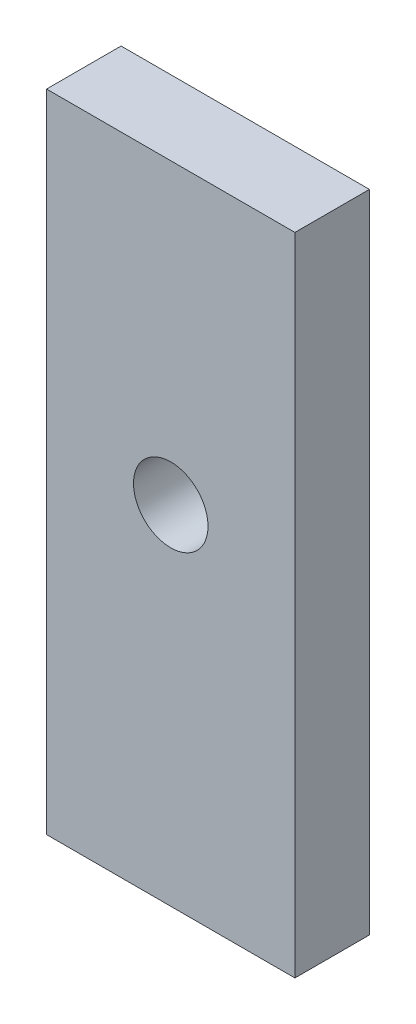
from build123d import *

# Parameters (mm, degrees)
SKETCH_1_W          = 10
SKETCH_1_H          = 26
EXTRUDE_1_DEPTH     = 3
SKETCH_2_R          = 1.5
CUT_EXTRUDE_1_DEPTH = 29.017851452


with BuildPart() as part:
    # Эскиз1 → Бобышка-Вытянуть1 (new body)
    with BuildSketch(Plane.XY):
        with Locations((5, 13)):
            Rectangle(SKETCH_1_W, SKETCH_1_H)
    extrude(amount=EXTRUDE_1_DEPTH)

    # Эскиз2 → Вырез-Вытянуть1 (cut, through all)
    with BuildSketch(Plane.XY.offset(3)):
        with Locations((5, 14)):
            Circle(SKETCH_2_R)
    extrude(amount=-CUT_EXTRUDE_1_DEPTH, mode=Mode.SUBTRACT)


solid = part.part
